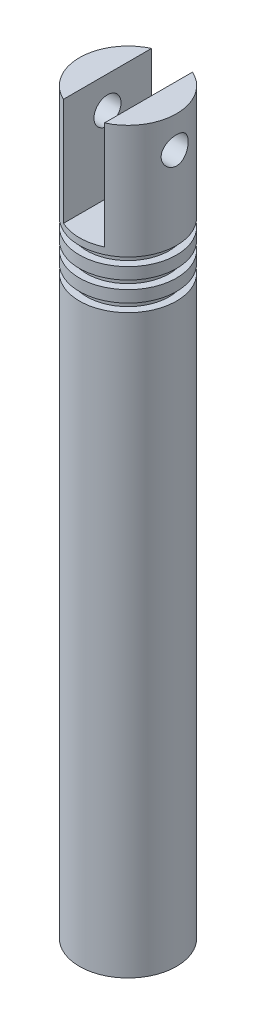
from build123d import *

# Parameters (mm, degrees)
SKETCH1_R               = 5.56895
BOSS_EXTRUDE1_DEPTH     = 84.66582
SKETCH2_W               = 4.699
SKETCH2_H               = 16.131480258
CUT_EXTRUDE1_DEPTH      = 12.319
CUT_EXTRUDE2_DEPTH      = 86.031332369
CUT_EXTRUDE2_DEPTH_BACK = 86.031332369
SKETCH3_R               = 1.5494
SKETCH4_W               = 0.843885596
SKETCH4_H               = 0.947610215
LPATTERN1_COUNT         = 3
LPATTERN1_PITCH         = 2.286


with BuildPart() as part:
    # Sketch1 → Boss-Extrude1 (new body)
    with BuildSketch(Plane(origin=(0, 0, 0), x_dir=(1, 0, 0), z_dir=(0, 1, 0))):
        with Locations(Location((0, 0, 0), (0, 0, 270))):
            Circle(SKETCH1_R)
    extrude(amount=BOSS_EXTRUDE1_DEPTH)

    # Sketch2 → Cut-Extrude1 (cut)
    with BuildSketch(Plane(origin=(0, 84.66582, 0), x_dir=(1, 0, 0), z_dir=(0, 1, 0))):
        Rectangle(SKETCH2_W, SKETCH2_H)
    extrude(amount=-CUT_EXTRUDE1_DEPTH, mode=Mode.SUBTRACT)

    # Sketch3 → Cut-Extrude2 (cut, two sides: drawn at the far end of the back side and taken through both)
    with BuildSketch(Plane(origin=(0, 0, 0), x_dir=(0, 0, -1), z_dir=(1, 0, 0)).offset(-CUT_EXTRUDE2_DEPTH_BACK)):
        with Locations(Location((0, 81.03362, 0), (0, 0, 270))):
            Circle(SKETCH3_R)
    extrude(amount=CUT_EXTRUDE2_DEPTH + CUT_EXTRUDE2_DEPTH_BACK, mode=Mode.SUBTRACT)

    # Sketch4 → Cut-Revolve1 (revolve, cut)
    with BuildSketch(Plane(origin=(0, 0, 0), x_dir=(0, 0, -1), z_dir=(1, 0, 0))):
        with Locations((5.147007202, 71.109959008)):
            Rectangle(SKETCH4_W, SKETCH4_H)
    cut_revolve1 = revolve(axis=Axis((0, -4.233291, 0), (0, 1, 0)), mode=Mode.SUBTRACT)

    # LPattern1: Cut-Revolve1 ×3
    with Locations(*[(0, -i * LPATTERN1_PITCH, 0) for i in range(1, LPATTERN1_COUNT)]):
        add(cut_revolve1, mode=Mode.SUBTRACT)


solid = part.part
